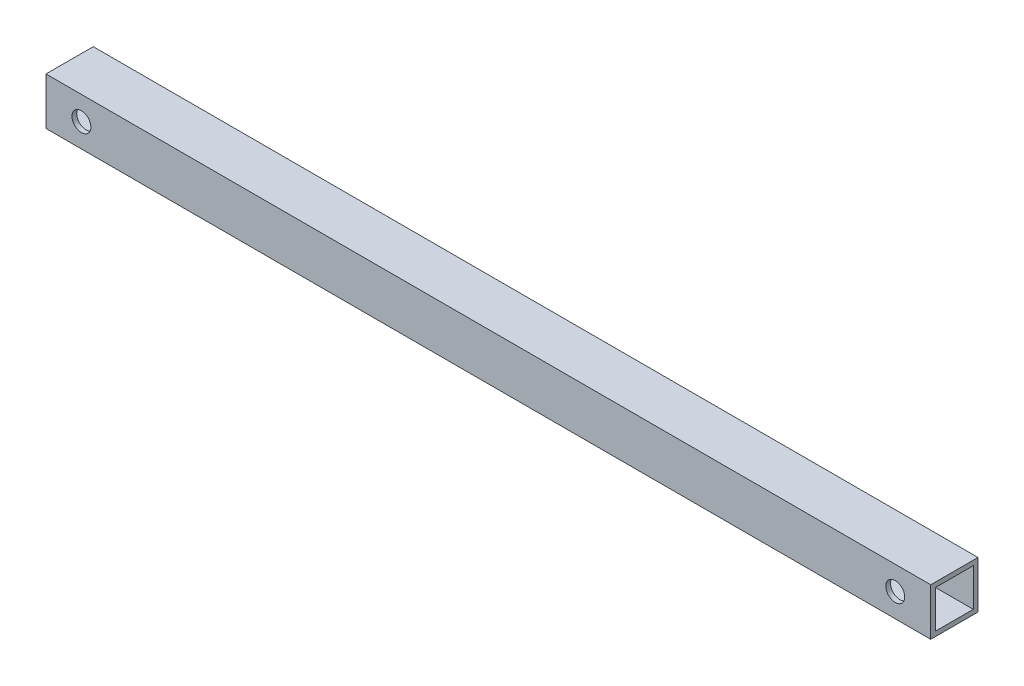
from build123d import *

# Parameters (mm, degrees)
SKETCH_1_W          = 10
SKETCH_1_H          = 10
SKETCH_1_W_2        = 8
SKETCH_1_H_2        = 8
EXTRUDE_1_DEPTH     = 187.2
SKETCH_2_R          = 2
CUT_EXTRUDE_1_DEPTH = 188.533570328


with BuildPart() as part:
    # ｽｹｯﾁ1 → 押し出し-薄板1 (new body)
    with BuildSketch(Plane(origin=(0, 0, 0), x_dir=(0, 0, -1), z_dir=(1, 0, 0))):
        Rectangle(SKETCH_1_W, SKETCH_1_H)
        Rectangle(SKETCH_1_W_2, SKETCH_1_H_2, mode=Mode.SUBTRACT)
    extrude(amount=EXTRUDE_1_DEPTH)

    # ｽｹｯﾁ2 → ｶｯﾄ - 押し出し1 (cut, through all)
    with BuildSketch(Plane.XY.offset(5)):
        with Locations((7.5, 0)):
            Circle(SKETCH_2_R)
        with Locations(Location((179.7, 0, 0), (0, 0, 180))):
            Circle(SKETCH_2_R)
    extrude(amount=-CUT_EXTRUDE_1_DEPTH, mode=Mode.SUBTRACT)


solid = part.part
